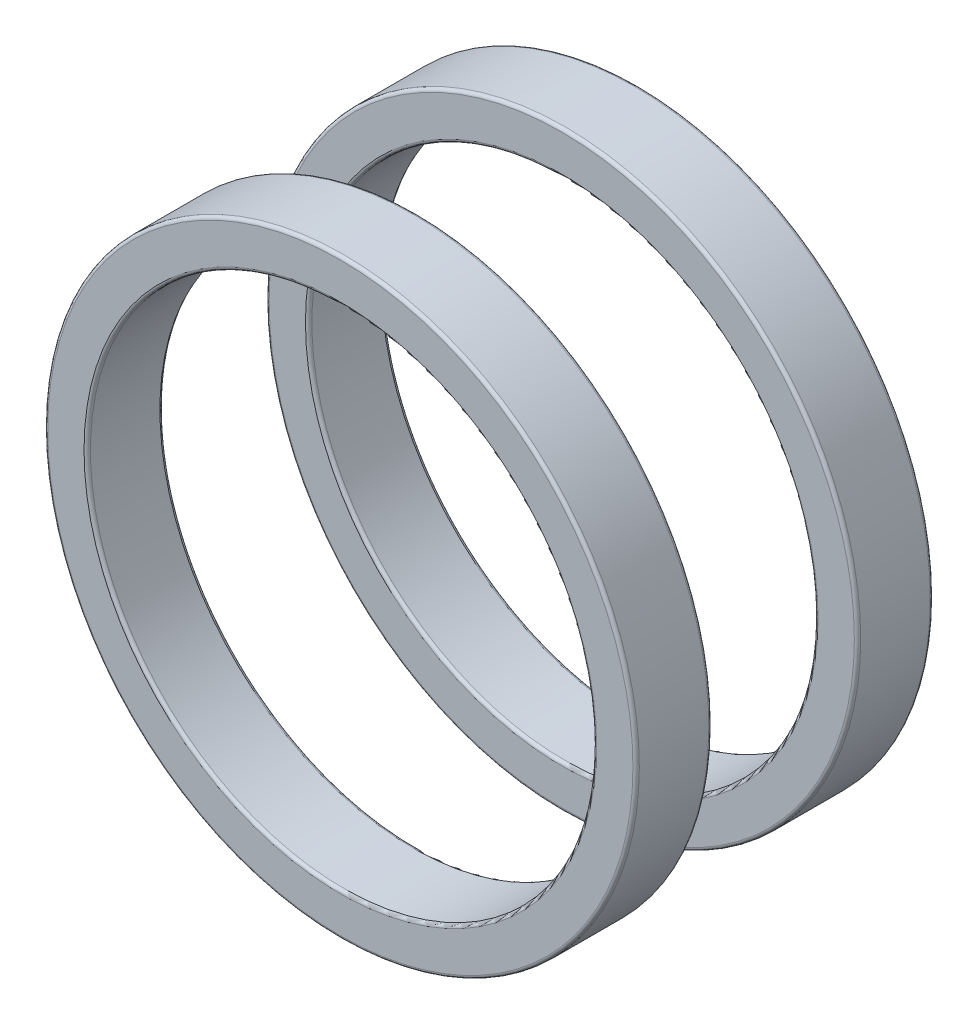
from build123d import *


with BuildPart() as part:
    # Bearing Shields Revolve Profile → Bearing Shields Revolve (revolve)
    with BuildSketch(Plane(origin=(0, 0, 0), x_dir=(0, 0, -1), z_dir=(1, 0, 0))):
        with BuildLine():
            Line((-2.31394, 4.705035989), (-1.208005295, 4.705035989))
            ThreePointArc((-1.208005295, 4.705035989), (-1.17208427, 4.690157013), (-1.157205295, 4.654235989))
            Line((-1.157205295, 4.654235989), (-1.157205295, 4.077014011))
            ThreePointArc((-1.157205295, 4.077014011), (-1.17208427, 4.041092987), (-1.208005295, 4.026214011))
            Line((-1.208005295, 4.026214011), (-2.31394, 4.026214011))
            ThreePointArc((-2.31394, 4.026214011), (-2.349861024, 4.041092987), (-2.36474, 4.077014011))
            Line((-2.36474, 4.077014011), (-2.36474, 4.654235989))
            ThreePointArc((-2.36474, 4.654235989), (-2.349861024, 4.690157013), (-2.31394, 4.705035989))
        make_face()
        with BuildLine():
            Line((2.31394, 4.705035989), (1.208005295, 4.705035989))
            ThreePointArc((1.208005295, 4.705035989), (1.17208427, 4.690157013), (1.157205295, 4.654235989))
            Line((1.157205295, 4.654235989), (1.157205295, 4.077014011))
            ThreePointArc((1.157205295, 4.077014011), (1.17208427, 4.041092987), (1.208005295, 4.026214011))
            Line((1.208005295, 4.026214011), (2.31394, 4.026214011))
            ThreePointArc((2.31394, 4.026214011), (2.349861024, 4.041092987), (2.36474, 4.077014011))
            Line((2.36474, 4.077014011), (2.36474, 4.654235989))
            ThreePointArc((2.36474, 4.654235989), (2.349861024, 4.690157013), (2.31394, 4.705035989))
        make_face()
    revolve(axis=Axis((0, 0, 2.4892), (0, 0, -1)))


solid = part.part
